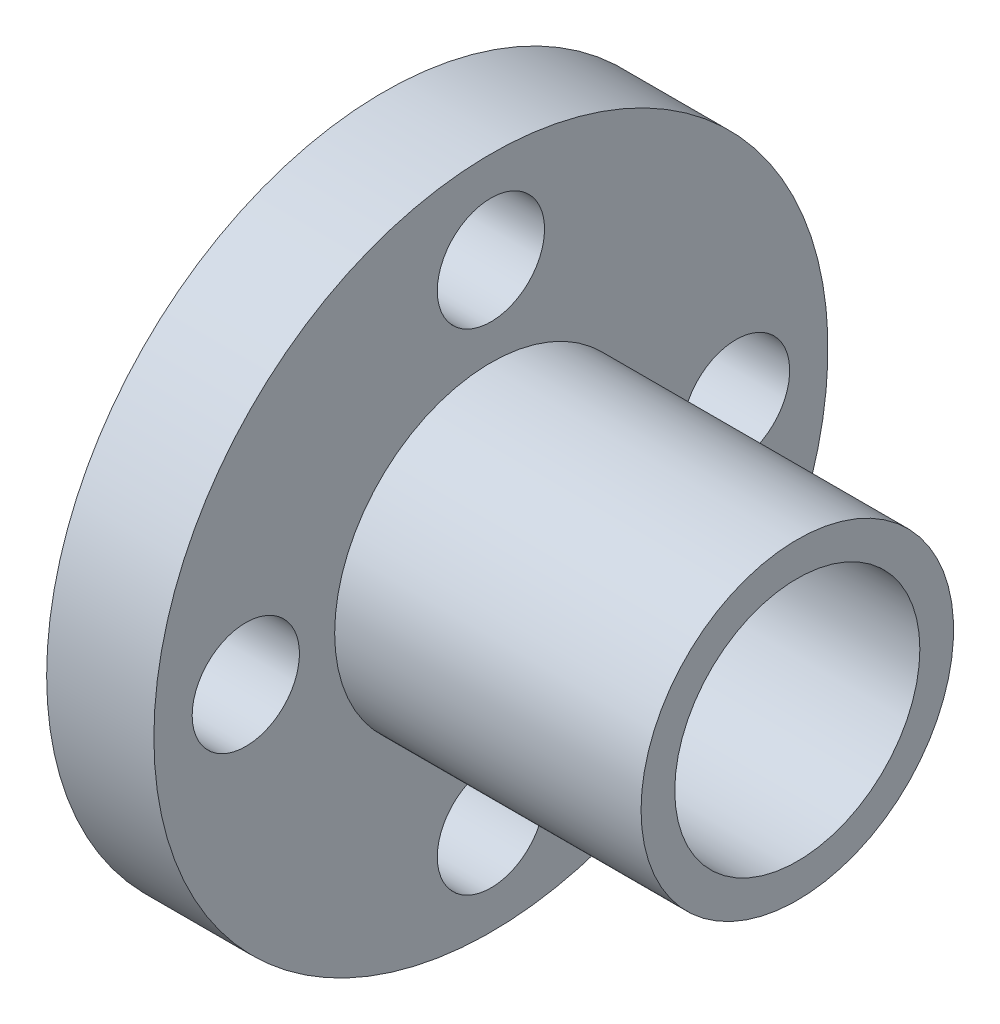
from build123d import *

# Parameters (mm, degrees)
SKETCH_4_R          = 1.75
CUT_EXTRUDE_1_DEPTH = 21.597329924


with BuildPart() as part:
    # 草图1 → 旋转1 (revolve)
    with BuildSketch(Plane.XY, mode=Mode.PRIVATE) as revolve_1_sk:
        Polygon((-9.353516821, 5.1), (-7.853516821, 5.1), (-7.853516821, 11), (-4.353516821, 11), (-4.353516821, 9.75), (-4.353516821, 8), (-4.353516821, 5.1), (5.646483179, 5.1), (5.646483179, 4), (-9.353516821, 4), align=None)
    revolve(revolve_1_sk.sketch.rotate(Axis((0, 0, 0), (1, 0, 0)), 90), axis=Axis((0, 0, 0), (1, 0, 0)))

    # 草图4 → 切除-拉伸1 (cut, through all)
    with BuildSketch(Plane.ZY.offset(7.853516821)):
        with Locations((8, 0)):
            Circle(SKETCH_4_R)
        with Locations((0, -8)):
            Circle(SKETCH_4_R)
        with Locations((-8, 0)):
            Circle(SKETCH_4_R)
        with Locations((0, 8)):
            Circle(SKETCH_4_R)
    extrude(amount=-CUT_EXTRUDE_1_DEPTH, mode=Mode.SUBTRACT)


solid = part.part
